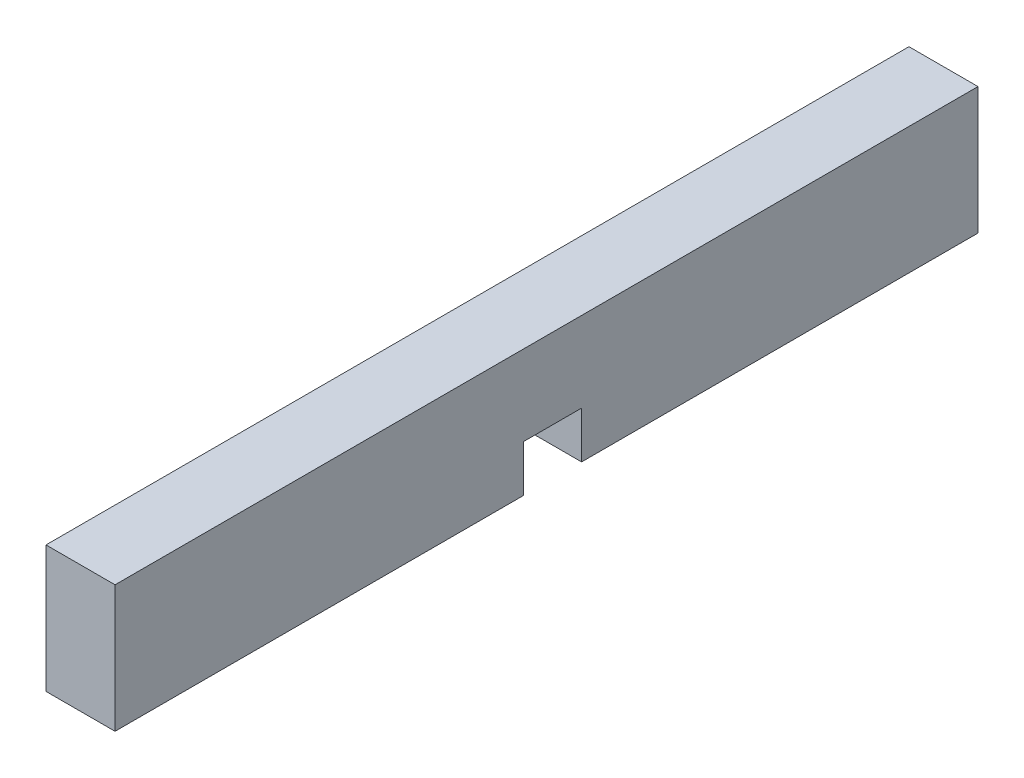
from build123d import *

# Parameters (mm, degrees)
SKETCH1_W               = 58.7248
SKETCH1_H               = 8.636
BOSS_EXTRUDE1_DEPTH     = 2.3495
CUT_EXTRUDE1_DEPTH      = 31.047899407
CUT_EXTRUDE1_DEPTH_BACK = 31.047899407
SKETCH2_W               = 3.9624
SKETCH2_H               = 3.175


with BuildPart() as part:
    # Sketch1 → Boss-Extrude1 (new, symmetric)
    with BuildSketch(Plane(origin=(0, 0, 0), x_dir=(0, 0, -1), z_dir=(1, 0, 0))):
        Rectangle(SKETCH1_W, SKETCH1_H)
    extrude(amount=BOSS_EXTRUDE1_DEPTH, both=True)

    # Sketch2 → Cut-Extrude1 (cut, two sides: drawn at the far end of the back side and taken through both)
    with BuildSketch(Plane(origin=(2.3495, 0, 0), x_dir=(0, 0, -1), z_dir=(1, 0, 0)).offset(-CUT_EXTRUDE1_DEPTH_BACK)):
        with Locations((0.4064, -2.7305)):
            Rectangle(SKETCH2_W, SKETCH2_H)
    extrude(amount=CUT_EXTRUDE1_DEPTH + CUT_EXTRUDE1_DEPTH_BACK, mode=Mode.SUBTRACT)


solid = part.part
